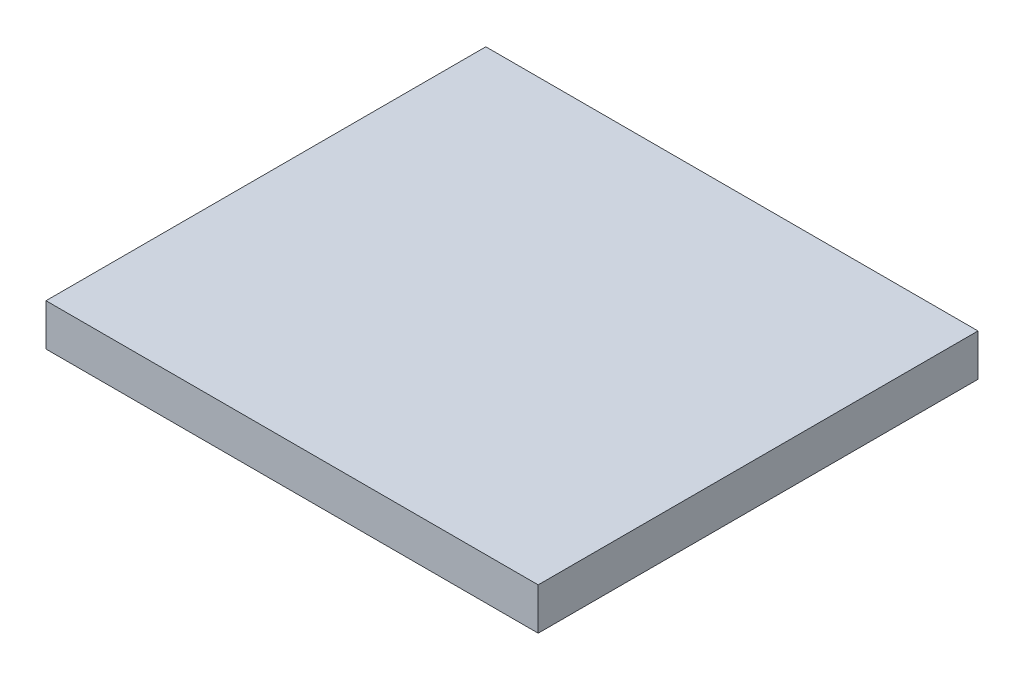
from build123d import *

# Parameters (mm, degrees)
SKETCH1_W           = 141
SKETCH1_H           = 126
SKETCH1_W_2         = 131
SKETCH1_H_2         = 116
BOSS_EXTRUDE1_DEPTH = 10
SKETCH1_2_W         = 141
SKETCH1_2_H         = 126
BOSS_EXTRUDE2_DEPTH = 2


with BuildPart() as part:
    # Sketch1 → Boss-Extrude1 (new body)
    with BuildSketch(Plane(origin=(0, 0, 0), x_dir=(1, 0, 0), z_dir=(0, 1, 0))):
        with Locations((70.5, 63)):
            Rectangle(SKETCH1_W, SKETCH1_H)
        with Locations((70.5, 63)):
            Rectangle(SKETCH1_W_2, SKETCH1_H_2, mode=Mode.SUBTRACT)
    extrude(amount=-BOSS_EXTRUDE1_DEPTH)

    # Sketch1<2> → Boss-Extrude2 (add)
    with BuildSketch(Plane(origin=(0, 0, 0), x_dir=(1, 0, 0), z_dir=(0, 1, 0))):
        with Locations((70.5, 63)):
            Rectangle(SKETCH1_2_W, SKETCH1_2_H)
    extrude(amount=BOSS_EXTRUDE2_DEPTH)


solid = part.part
